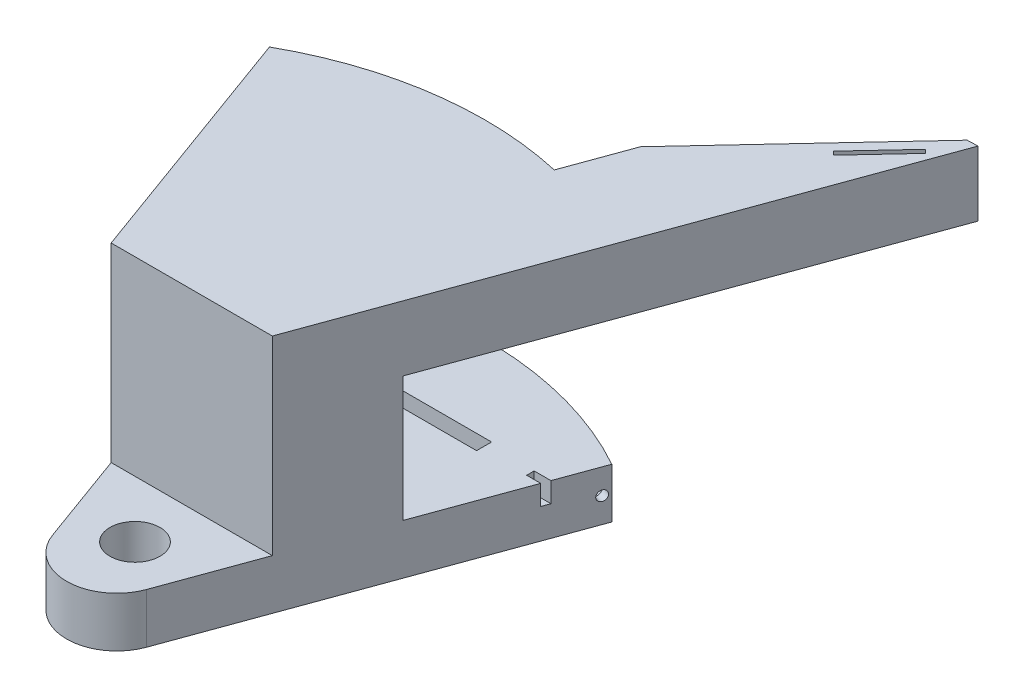
from build123d import *

# Parameters (mm, degrees)
EXTRUDE_1_DEPTH            = 48
CUT_EXTRUDE_2_REACH        = 96.508
CUT_EXTRUDE_2_START_RADIUS = 70
CUT_EXTRUDE_2_END_RADIUS   = 70
SKETCH_3_W                 = 58.404028666
SKETCH_3_H                 = 6
EXTRUDE_2_DEPTH            = 13
CUT_EXTRUDE_3_DEPTH        = 140.034418617
CUT_EXTRUDE_3_DEPTH_BACK   = 140.034418617
SKETCH_4_W                 = 25
SKETCH_4_H                 = 38
SKETCH_4_W_2               = 40
SKETCH_4_H_2               = 25
CHAMFER_1_SIZE             = 5
CHAMFER_1_SIZE2            = 3.813196151
SKETCH_6_R                 = 6.5
CUT_EXTRUDE_4_DEPTH        = 2
SKETCH_7_R                 = 1.5
CUT_EXTRUDE_5_DEPTH        = 60
SKETCH_8_W                 = 9
SKETCH_8_H                 = 9
CUT_EXTRUDE_6_DEPTH        = 11
CUT_EXTRUDE_8_REACH        = 137.533
SKETCH_10_R                = 1
CUT_EXTRUDE_9_REACH        = 105.034
CUT_EXTRUDE_9_END_RADIUS   = 70
SKETCH_11_R                = 0.75
SKETCH_12_W                = 20
SKETCH_12_H                = 3
CUT_EXTRUDE_10_DEPTH       = 11
SKETCH_13_W                = 3.868283576
SKETCH_13_H                = 1.5
CUT_EXTRUDE_11_DEPTH       = 4
CUT_EXTRUDE_12_REACH       = 137.476


with BuildPart() as part:
    # 草图1 → 凸台-拉伸1 (new body)
    with BuildSketch(Plane(origin=(0, 0, 0), x_dir=(1, 0, 0), z_dir=(0, 1, 0))):
        with BuildLine():
            ThreePointArc((-9.396926208, -7.075874358), (-5.735764364, -11.847193368), (0, -13.655672925))
            Line((0, -13.655672925), (0, -5))
            ThreePointArc((0, -5), (-5, 0), (0, 5))
            Line((0, 5), (0, 70))
            ThreePointArc((0, 70), (-17.673593853, 67.732149533), (-34.202014333, 61.075545152))
            Line((-34.202014333, 61.075545152), (-9.396926208, -7.075874358))
        make_face()
        with BuildLine():
            Line((0, -5), (0, -13.655672925))
            ThreePointArc((0, -13.655672925), (5.735764364, -11.847193368), (9.396926208, -7.075874358))
            Line((9.396926208, -7.075874358), (34.202014333, 61.075545152))
            ThreePointArc((34.202014333, 61.075545152), (17.673593853, 67.732149533), (0, 70))
            Line((0, 70), (0, 5))
            ThreePointArc((0, 5), (3.535533906, 3.535533906), (5, 0))
            ThreePointArc((5, 0), (3.535533906, -3.535533906), (0, -5))
        make_face()
    extrude(amount=EXTRUDE_1_DEPTH)

    # 切除-拉伸2: from a cylinder face, 96.508 long prism both ways, kept between that surface and its translate by the depth
    cut_extrude_2_start = Plane(origin=(0, 5, 0), z_dir=(0, -1, 0)) * Cylinder(CUT_EXTRUDE_2_START_RADIUS, 334.016, mode=Mode.PRIVATE)
    cut_extrude_2_end = Plane(origin=(0, 5, 3), z_dir=(0, -1, 0)) * Cylinder(CUT_EXTRUDE_2_END_RADIUS, 334.016, mode=Mode.PRIVATE)
    # 草图3 → 切除-拉伸2 (cut, from a surface)
    with BuildSketch(Plane.XY, mode=Mode.PRIVATE) as cut_extrude_2_sk1:
        with Locations((3, 5)):
            Rectangle(SKETCH_3_W, SKETCH_3_H)
    cut_extrude_2_tool1 = extrude(cut_extrude_2_sk1.sketch, amount=CUT_EXTRUDE_2_REACH, both=True, mode=Mode.PRIVATE)
    add(((cut_extrude_2_tool1 & cut_extrude_2_start) - cut_extrude_2_end).solids().sort_by_distance((3, 5, -62.032204))[0], mode=Mode.SUBTRACT)

    # 草图2 → 凸台-拉伸2 (add)
    with BuildSketch(Plane(origin=(0, 48, 0), x_dir=(1, 0, 0), z_dir=(0, 1, 0))):
        Polygon((24.252642572, 33.739870901), (55.034455471, 118.312206771), (20.125623779, 80.877067961), (5.458790156, 40.580273767), align=None)
    extrude(amount=-EXTRUDE_2_DEPTH)

    # 草图4 → 切除-拉伸3 (cut, two sides: drawn at the far end of the back side and taken through both)
    with BuildSketch(Plane(origin=(0, 0, 0), x_dir=(0, 0, -1), z_dir=(1, 0, 0)).offset(-CUT_EXTRUDE_3_DEPTH_BACK)):
        with Locations((-1.155672925, 29)):
            Rectangle(SKETCH_4_W, SKETCH_4_H)
        with Locations((50.466884927, 22.5)):
            Rectangle(SKETCH_4_W_2, SKETCH_4_H_2)
    extrude(amount=CUT_EXTRUDE_3_DEPTH + CUT_EXTRUDE_3_DEPTH_BACK, mode=Mode.SUBTRACT)

    # 倒角1
    chamfer_1_edges = [part.edges().sort_by_distance(p)[0] for p in [
        (55.034455471, 41.5, -118.312206771),
    ]]
    chamfer_1_side = [part.faces().sort_by_distance(p)[0] for p in [
        (37.580039625, 41.5, -99.594637366),
    ]]
    chamfer(chamfer_1_edges, length=CHAMFER_1_SIZE, length2=CHAMFER_1_SIZE2, reference=chamfer_1_side[0])

    # 草图6 → 切除-拉伸4 (cut)
    with BuildSketch(Plane.XZ):
        with Locations(Location((0, 0, 0), (0, 0, 270))):
            Circle(SKETCH_6_R)
    extrude(amount=-CUT_EXTRUDE_4_DEPTH, mode=Mode.SUBTRACT)

    # 草图7 → 切除-拉伸5 (cut)
    with BuildSketch(Plane.XY):
        with Locations((-30.202014333, 5)):
            Circle(SKETCH_7_R)
    extrude(amount=-CUT_EXTRUDE_5_DEPTH, mode=Mode.SUBTRACT)

    # 草图8 → 切除-拉伸6 (cut)
    with BuildSketch(Plane(origin=(0, 10, 0), x_dir=(1, 0, 0), z_dir=(0, 1, 0))):
        with Locations((-30.258231885, 50.240091929)):
            Rectangle(SKETCH_8_W, SKETCH_8_H)
    extrude(amount=-CUT_EXTRUDE_6_DEPTH, mode=Mode.SUBTRACT)

    # 切除-拉伸8: up to this plane
    cut_extrude_8_end = Plane(origin=(32.202014333, 48, -62.153280468), z_dir=(-1, 0, 0))
    # 草图10 → 切除-拉伸8 (cut, up to the surface)
    with BuildSketch(Plane(origin=(10.571836839, 0, 3.847833931), x_dir=(0.34202014332566283, 0, -0.9396926207859106), z_dir=(0.9396926207859106, 0, 0.34202014332566283)), mode=Mode.PRIVATE) as cut_extrude_8_sk1:
        with Locations((67.590016934, 5)):
            Circle(SKETCH_10_R)
    cut_extrude_8_tool1 = split(extrude(cut_extrude_8_sk1.sketch, amount=-CUT_EXTRUDE_8_REACH, mode=Mode.PRIVATE), bisect_by=cut_extrude_8_end, keep=Keep.BOTH, mode=Mode.PRIVATE)
    add(cut_extrude_8_tool1.solids().sort_by_distance((33.688984, 5, -59.666006))[0], mode=Mode.SUBTRACT)

    # 切除-拉伸9: up to this cylinder (the profile starts inside it)
    cut_extrude_9_end = Plane(origin=(0, 5, 0), z_dir=(0, -1, 0)) * Cylinder(CUT_EXTRUDE_9_END_RADIUS, 351.068, mode=Mode.PRIVATE)
    # 草图11 → 切除-拉伸9 (cut, up to the surface)
    with BuildSketch(Plane.XY.offset(-60), mode=Mode.PRIVATE) as cut_extrude_9_sk1:
        with Locations((-30.202014333, 5)):
            Circle(SKETCH_11_R)
    cut_extrude_9_tool1 = extrude(cut_extrude_9_sk1.sketch, amount=-CUT_EXTRUDE_9_REACH, mode=Mode.PRIVATE) & cut_extrude_9_end
    add(cut_extrude_9_tool1.solids().sort_by_distance((-30.202014, 5, -60))[0], mode=Mode.SUBTRACT)

    # 草图12 → 切除-拉伸10 (cut)
    with BuildSketch(Plane(origin=(0, 10, 0), x_dir=(1, 0, 0), z_dir=(0, 1, 0))):
        with Locations((8.346963974, 51.411545488)):
            Rectangle(SKETCH_12_W, SKETCH_12_H)
    extrude(amount=-CUT_EXTRUDE_10_DEPTH, mode=Mode.SUBTRACT)

    # 草图13 → 切除-拉伸11 (cut)
    with BuildSketch(Plane(origin=(0, 10, 0), x_dir=(1, 0, 0), z_dir=(0, 1, 0))):
        with Locations((29.542762739, 51.411545488)):
            Rectangle(SKETCH_13_W, SKETCH_13_H)
    extrude(amount=-CUT_EXTRUDE_11_DEPTH, mode=Mode.SUBTRACT)

    # 草图14 → 切除-拉伸12 (cut, up to next)
    with BuildSketch(Plane(origin=(0, 48, 0), x_dir=(1, 0, 0), z_dir=(0, 1, 0)), mode=Mode.PRIVATE) as cut_extrude_12_sk1:
        Polygon((49.766128767, 108.223290792), (49.034775066, 108.905289152), (40.168796385, 99.397691031), (40.900150086, 98.715692671), align=None)
    cut_extrude_12_tool1 = extrude(cut_extrude_12_sk1.sketch, amount=-CUT_EXTRUDE_12_REACH, mode=Mode.PRIVATE) & part.part
    add(cut_extrude_12_tool1.solids().sort_by_distance((44.967463, 48, -103.810491))[0], mode=Mode.SUBTRACT)


solid = part.part
